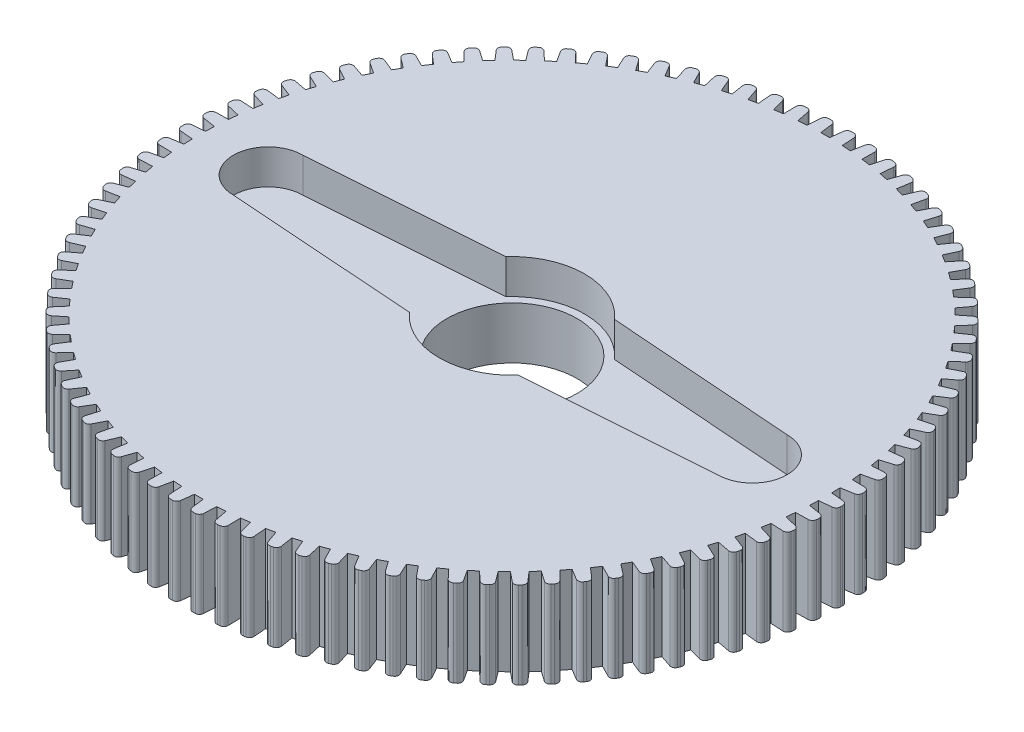
from build123d import *

# Parameters (mm, degrees)
SKETCH1_R                = 19
BOSS_EXTRUDE1_DEPTH      = 5
CUT_EXTRUDE2_DEPTH       = 2
SKETCH4_R                = 3.75
CUT_EXTRUDE3_DEPTH       = 3
CUT_EXTRUDE4_DEPTH       = 5
FILLET1_R                = 0.25
CIRPATTERN1_COUNT        = 90
FILLET1_OF_CIRPATTERN1_R = 0.25


with BuildPart() as part:
    # Sketch1 → Boss-Extrude1 (new body)
    with BuildSketch(Plane(origin=(0, 0, 0), x_dir=(1, 0, 0), z_dir=(0, 1, 0))):
        with Locations(Location((0, 0, 0), (0, 0, 270))):
            Circle(SKETCH1_R)
    extrude(amount=BOSS_EXTRUDE1_DEPTH)

    # Sketch2 → Cut-Extrude2 (cut)
    with BuildSketch(Plane(origin=(0, 5, 0), x_dir=(1, 0, 0), z_dir=(0, 1, 0))):
        with BuildLine():
            Line((-3.141265312, -2.775594211), (-14.058542875, -2))
            ThreePointArc((-14.058542875, -2), (-16.058542875, 0), (-14.058542875, 2))
            Line((-14.058542875, 2), (-3.136113737, 2.7814136))
            ThreePointArc((-3.136113737, 2.7814136), (0, 4.191833845), (3.136113737, 2.7814136))
            Line((3.136113737, 2.7814136), (13.862414246, 2))
            ThreePointArc((13.862414246, 2), (15.862414246, 0), (13.862414246, -2))
            Line((13.862414246, -2), (3.141289797, -2.7755665))
            ThreePointArc((3.141289797, -2.7755665), (1.8489e-05, -4.191833845), (-3.141265312, -2.775594211))
        make_face()
    extrude(amount=-CUT_EXTRUDE2_DEPTH, mode=Mode.SUBTRACT)

    # Sketch4 → Cut-Extrude3 (cut)
    with BuildSketch(Plane(origin=(0, 3, 0), x_dir=(1, 0, 0), z_dir=(0, 1, 0))):
        with Locations(Location((0, 0, 0), (0, 0, 270))):
            Circle(SKETCH4_R)
    extrude(amount=-CUT_EXTRUDE3_DEPTH, mode=Mode.SUBTRACT)

    # Sketch7 → Cut-Extrude4 (cut)
    with BuildSketch(Plane.XZ):
        Polygon((-0.25, 18.05701656), (0.25, 18.05701656), (0.5, 20.05701656), (-0.5, 20.05701656), align=None)
    cut_extrude4 = extrude(amount=-CUT_EXTRUDE4_DEPTH, mode=Mode.SUBTRACT)

    # Fillet1
    fillet1_edges = [part.edges().sort_by_distance(p)[0] for p in [
        (-0.367428797, 2.5, 18.996446933),
        (0.367428797, 2.5, 18.996446933),
    ]]
    fillet(fillet1_edges, radius=FILLET1_R)

    # CirPattern1: Cut-Extrude4 ×90 about axis
    cirpattern1_axis = Axis((0, 0, 0), (0, 1, 0))
    for i in range(1, CIRPATTERN1_COUNT):
        add(cut_extrude4.rotate(cirpattern1_axis, i * 360 / CIRPATTERN1_COUNT), mode=Mode.SUBTRACT)

    # Fillet1 of CirPattern1
    fillet1_of_cirpattern1_edges = [part.edges().sort_by_distance(p)[0] for p in [
        (0.958591393, 2.5, 18.97580308),
        (1.69165891, 2.5, 18.924542006),
        (2.279941422, 2.5, 18.862711022),
        (3.007647432, 2.5, 18.760438612),
        (3.590183806, 2.5, 18.657721732),
        (4.308982997, 2.5, 18.504936248),
        (4.882935174, 2.5, 18.361833898),
        (5.589325631, 2.5, 18.159279694),
        (6.151897374, 2.5, 17.976489054),
        (6.842437632, 2.5, 17.725152954),
        (7.390888148, 2.5, 17.503564562),
        (8.062213964, 2.5, 17.204671052),
        (8.593871258, 2.5, 16.945364464),
        (9.242712001, 2.5, 16.600369721),
        (9.75498589, 2.5, 16.304608253),
        (10.378180473, 2.5, 15.915193058),
        (10.868575213, 2.5, 15.584417629),
        (11.463087494, 2.5, 15.152479174),
        (11.929213929, 2.5, 14.78830129),
        (12.492147504, 2.5, 14.315943934),
        (12.931734714, 2.5, 13.920137833),
        (13.460347028, 2.5, 13.409662855),
        (13.871253387, 2.5, 12.984156864),
        (14.362969094, 2.5, 12.438051246),
        (14.743192709, 2.5, 11.984918388),
        (15.195616219, 2.5, 11.405842702),
        (15.543304677, 2.5, 10.927290594),
        (15.954231828, 2.5, 10.318066038),
        (16.267691227, 2.5, 9.816426138),
        (16.635120024, 2.5, 9.180020795),
        (16.912823221, 2.5, 8.657737042),
        (17.234963587, 2.5, 7.997251412),
        (17.475557641, 2.5, 7.456868321),
        (17.75084014, 2.5, 6.775520225),
        (17.9531529, 2.5, 6.219670486),
        (18.180236384, 2.5, 5.520779384),
        (18.343282203, 2.5, 4.952171043),
        (18.521060345, 2.5, 4.239141861),
        (18.644044878, 2.5, 3.66054512),
        (18.77165156, 2.5, 2.936851664),
        (18.853975642, 2.5, 2.351085389),
        (18.930789177, 2.5, 1.620253422),
        (18.972051731, 2.5, 1.030171406),
        (18.997697891, 2.5, 0.295761468),
        (18.997697891, 2.5, -0.295761468),
        (18.972051731, 2.5, -1.030171406),
        (18.930789177, 2.5, -1.620253422),
        (18.853975642, 2.5, -2.351085389),
        (18.77165156, 2.5, -2.936851664),
        (18.644044878, 2.5, -3.66054512),
        (18.521060345, 2.5, -4.239141861),
        (18.343282203, 2.5, -4.952171043),
        (18.180236384, 2.5, -5.520779384),
        (17.9531529, 2.5, -6.219670486),
        (17.75084014, 2.5, -6.775520225),
        (17.475557641, 2.5, -7.456868321),
        (17.234963587, 2.5, -7.997251412),
        (16.912823221, 2.5, -8.657737042),
        (16.635120024, 2.5, -9.180020795),
        (16.267691227, 2.5, -9.816426138),
        (15.954231828, 2.5, -10.318066038),
        (15.543304677, 2.5, -10.927290594),
        (15.195616219, 2.5, -11.405842702),
        (14.743192709, 2.5, -11.984918388),
        (14.362969094, 2.5, -12.438051246),
        (13.871253387, 2.5, -12.984156864),
        (13.460347028, 2.5, -13.409662855),
        (12.931734714, 2.5, -13.920137833),
        (12.492147504, 2.5, -14.315943934),
        (11.929213929, 2.5, -14.78830129),
        (11.463087494, 2.5, -15.152479174),
        (10.868575213, 2.5, -15.584417629),
        (10.378180473, 2.5, -15.915193058),
        (9.75498589, 2.5, -16.304608253),
        (9.242712001, 2.5, -16.600369721),
        (8.593871258, 2.5, -16.945364464),
        (8.062213964, 2.5, -17.204671052),
        (7.390888148, 2.5, -17.503564562),
        (6.842437632, 2.5, -17.725152954),
        (6.151897374, 2.5, -17.976489054),
        (5.589325631, 2.5, -18.159279694),
        (4.882935174, 2.5, -18.361833898),
        (4.308982997, 2.5, -18.504936248),
        (3.590183806, 2.5, -18.657721732),
        (3.007647432, 2.5, -18.760438612),
        (2.279941422, 2.5, -18.862711022),
        (1.69165891, 2.5, -18.924542006),
        (0.958591393, 2.5, -18.97580308),
        (0.367428797, 2.5, -18.996446933),
        (-0.367428797, 2.5, -18.996446933),
        (-0.958591393, 2.5, -18.97580308),
        (-1.69165891, 2.5, -18.924542006),
        (-2.279941422, 2.5, -18.862711022),
        (-3.007647432, 2.5, -18.760438612),
        (-3.590183806, 2.5, -18.657721732),
        (-4.308982997, 2.5, -18.504936248),
        (-4.882935174, 2.5, -18.361833898),
        (-5.589325631, 2.5, -18.159279694),
        (-6.151897374, 2.5, -17.976489054),
        (-6.842437632, 2.5, -17.725152954),
        (-7.390888148, 2.5, -17.503564562),
        (-8.062213964, 2.5, -17.204671052),
        (-8.593871258, 2.5, -16.945364464),
        (-9.242712001, 2.5, -16.600369721),
        (-9.75498589, 2.5, -16.304608253),
        (-10.378180473, 2.5, -15.915193058),
        (-10.868575213, 2.5, -15.584417629),
        (-11.463087494, 2.5, -15.152479174),
        (-11.929213929, 2.5, -14.78830129),
        (-12.492147504, 2.5, -14.315943934),
        (-12.931734714, 2.5, -13.920137833),
        (-13.460347028, 2.5, -13.409662855),
        (-13.871253387, 2.5, -12.984156864),
        (-14.362969094, 2.5, -12.438051246),
        (-14.743192709, 2.5, -11.984918388),
        (-15.195616219, 2.5, -11.405842702),
        (-15.543304677, 2.5, -10.927290594),
        (-15.954231828, 2.5, -10.318066038),
        (-16.267691227, 2.5, -9.816426138),
        (-16.635120024, 2.5, -9.180020795),
        (-16.912823221, 2.5, -8.657737042),
        (-17.234963587, 2.5, -7.997251412),
        (-17.475557641, 2.5, -7.456868321),
        (-17.75084014, 2.5, -6.775520225),
        (-17.9531529, 2.5, -6.219670486),
        (-18.180236384, 2.5, -5.520779384),
        (-18.343282203, 2.5, -4.952171043),
        (-18.521060345, 2.5, -4.239141861),
        (-18.644044878, 2.5, -3.66054512),
        (-18.77165156, 2.5, -2.936851664),
        (-18.853975642, 2.5, -2.351085389),
        (-18.930789177, 2.5, -1.620253422),
        (-18.972051731, 2.5, -1.030171406),
        (-18.997697891, 2.5, -0.295761468),
        (-18.997697891, 2.5, 0.295761468),
        (-18.972051731, 2.5, 1.030171406),
        (-18.930789177, 2.5, 1.620253422),
        (-18.853975642, 2.5, 2.351085389),
        (-18.77165156, 2.5, 2.936851664),
        (-18.644044878, 2.5, 3.66054512),
        (-18.521060345, 2.5, 4.239141861),
        (-18.343282203, 2.5, 4.952171043),
        (-18.180236384, 2.5, 5.520779384),
        (-17.9531529, 2.5, 6.219670486),
        (-17.75084014, 2.5, 6.775520225),
        (-17.475557641, 2.5, 7.456868321),
        (-17.234963587, 2.5, 7.997251412),
        (-16.912823221, 2.5, 8.657737042),
        (-16.635120024, 2.5, 9.180020795),
        (-16.267691227, 2.5, 9.816426138),
        (-15.954231828, 2.5, 10.318066038),
        (-15.543304677, 2.5, 10.927290594),
        (-15.195616219, 2.5, 11.405842702),
        (-14.743192709, 2.5, 11.984918388),
        (-14.362969094, 2.5, 12.438051246),
        (-13.871253387, 2.5, 12.984156864),
        (-13.460347028, 2.5, 13.409662855),
        (-12.931734714, 2.5, 13.920137833),
        (-12.492147504, 2.5, 14.315943934),
        (-11.929213929, 2.5, 14.78830129),
        (-11.463087494, 2.5, 15.152479174),
        (-10.868575213, 2.5, 15.584417629),
        (-10.378180473, 2.5, 15.915193058),
        (-9.75498589, 2.5, 16.304608253),
        (-9.242712001, 2.5, 16.600369721),
        (-8.593871258, 2.5, 16.945364464),
        (-8.062213964, 2.5, 17.204671052),
        (-7.390888148, 2.5, 17.503564562),
        (-6.842437632, 2.5, 17.725152954),
        (-6.151897374, 2.5, 17.976489054),
        (-5.589325631, 2.5, 18.159279694),
        (-4.882935174, 2.5, 18.361833898),
        (-4.308982997, 2.5, 18.504936248),
        (-3.590183806, 2.5, 18.657721732),
        (-3.007647432, 2.5, 18.760438612),
        (-2.279941422, 2.5, 18.862711022),
        (-1.69165891, 2.5, 18.924542006),
        (-0.958591393, 2.5, 18.97580308),
    ]]
    fillet(fillet1_of_cirpattern1_edges, radius=FILLET1_OF_CIRPATTERN1_R)


solid = part.part
